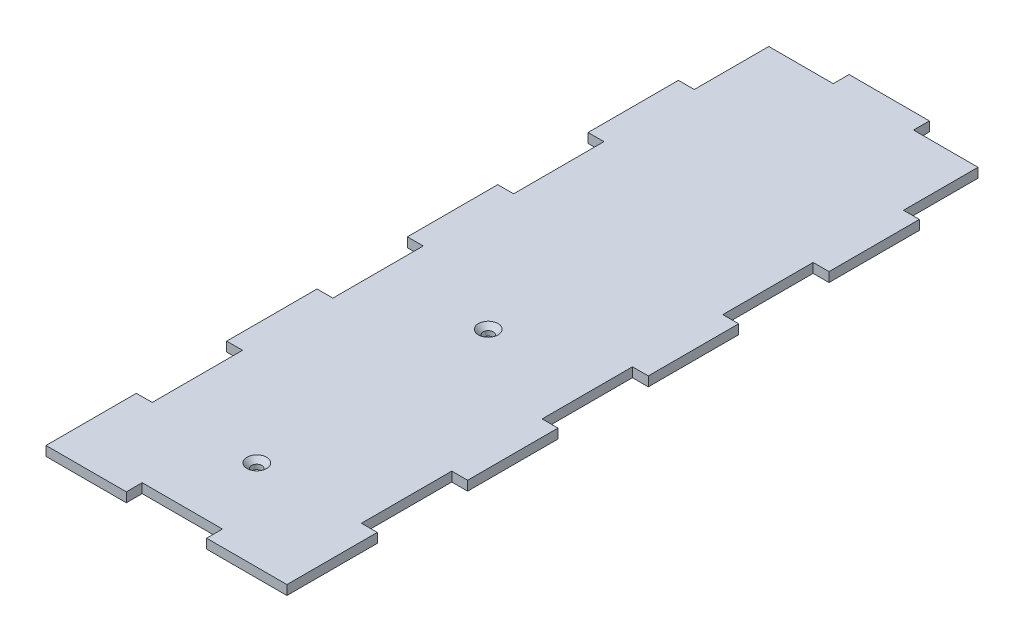
from build123d import *

# Parameters (mm, degrees)
BOSS_EXTRUDE1_DEPTH = 3
SKETCH2_R           = 1.6
CUT_EXTRUDE1_DEPTH  = 121.203993278
CHAMFER1_SIZE       = 1.5


with BuildPart() as part:
    # Sketch1 → Boss-Extrude1 (new body)
    with BuildSketch(Plane(origin=(0, 0, 0), x_dir=(1, 0, 0), z_dir=(0, 1, 0))):
        Polygon((-38, -114), (-12.666666667, -114), (-12.666666667, -109), (0, -109), (0, 114), (-12.666666667, 114), (-12.666666667, 109), (-33, 109), (-33, 85.5), (-38, 85.5), (-38, 57), (-33, 57), (-33, 28.5), (-38, 28.5), (-38, 0), (-33, 0), (-33, -28.5), (-38, -28.5), (-38, -57), (-33, -57), (-33, -85.5), (-38, -85.5), align=None)
    boss_extrude1 = extrude(amount=BOSS_EXTRUDE1_DEPTH)

    # Mirror1: Boss-Extrude1 across plane
    add(boss_extrude1.mirror(Plane(origin=(0, 3, 109), x_dir=(0, 0, 1), z_dir=(-1, 0, 0))))

    # Sketch2 → Cut-Extrude1 (cut, through all)
    with BuildSketch(Plane(origin=(0, 3, 0), x_dir=(1, 0, 0), z_dir=(0, 1, 0))):
        with Locations(Location((0, -85.5, 0), (0, 0, 270))):
            Circle(SKETCH2_R)
        with Locations(Location((0, -12.5, 0), (0, 0, 270))):
            Circle(SKETCH2_R)
    extrude(amount=-CUT_EXTRUDE1_DEPTH, mode=Mode.SUBTRACT)

    # Chamfer1
    chamfer1_edges = [part.edges().sort_by_distance(p)[0] for p in [
        (0, 3, 83.9),
        (0, 3, 10.9),
    ]]
    chamfer(chamfer1_edges, length=CHAMFER1_SIZE)


solid = part.part
